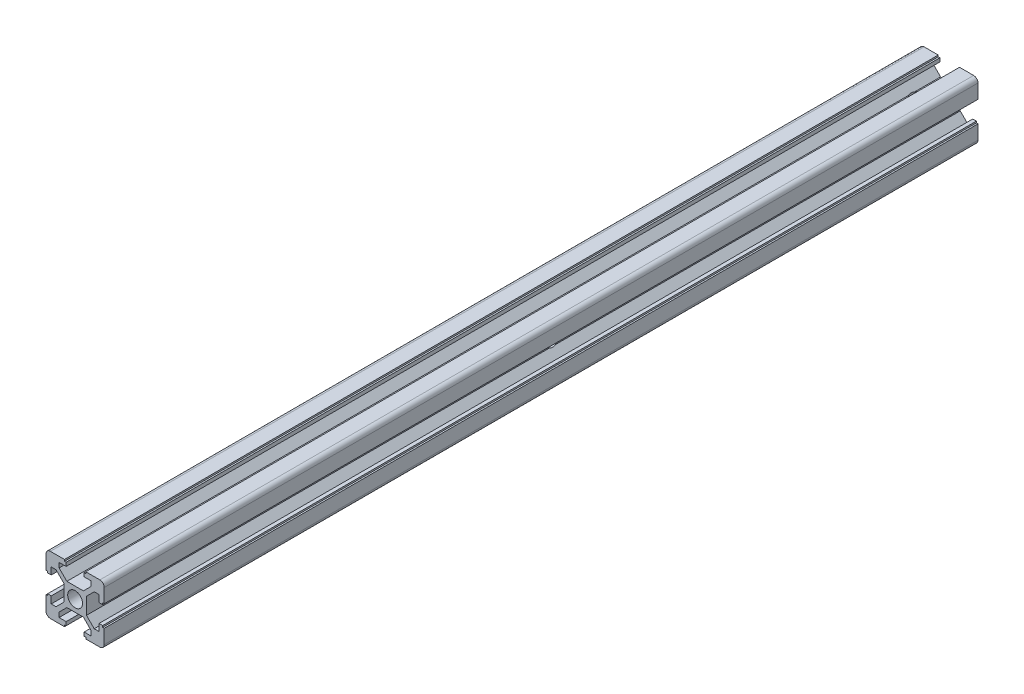
from build123d import *

# Parameters (mm, degrees)
SKETCH_1_R          = 2.55
EXTRUDE_1_DEPTH     = 300
SKETCH_2_R          = 3
CUT_EXTRUDE_1_DEPTH = 301.83217913
SKETCH_3_R          = 3
CUT_EXTRUDE_2_DEPTH = 301.83217923


with BuildPart() as part:
    # 草图1 → 凸台-拉伸1 (new body)
    with BuildSketch(Plane.XY):
        with BuildLine():
            Line((-3.9, 2.839339828), (-6.560660172, 5.5))
            Line((-6.560660172, 5.5), (-8.2, 5.5))
            Line((-8.2, 5.5), (-8.2, 3.1))
            Line((-8.2, 3.1), (-9.45, 3.1))
            Line((-9.45, 3.1), (-9.45, 3.65))
            Line((-9.45, 3.65), (-10, 3.65))
            Line((-10, 3.65), (-10, 8.5))
            ThreePointArc((-10, 8.5), (-9.560660172, 9.560660172), (-8.5, 10))
            Line((-8.5, 10), (-3.65, 10))
            Line((-3.65, 10), (-3.65, 9.45))
            Line((-3.65, 9.45), (-3.1, 9.45))
            Line((-3.1, 9.45), (-3.1, 8.2))
            Line((-3.1, 8.2), (-5.5, 8.2))
            Line((-5.5, 8.2), (-5.5, 6.560660172))
            Line((-5.5, 6.560660172), (-2.839339828, 3.9))
            Line((-2.839339828, 3.9), (2.839339828, 3.9))
            Line((2.839339828, 3.9), (5.5, 6.560660172))
            Line((5.5, 6.560660172), (5.5, 8.2))
            Line((5.5, 8.2), (3.1, 8.2))
            Line((3.1, 8.2), (3.1, 9.45))
            Line((3.1, 9.45), (3.65, 9.45))
            Line((3.65, 9.45), (3.65, 10))
            Line((3.65, 10), (8.5, 10))
            ThreePointArc((8.5, 10), (9.560660172, 9.560660172), (10, 8.5))
            Line((10, 8.5), (10, 3.65))
            Line((10, 3.65), (9.45, 3.65))
            Line((9.45, 3.65), (9.45, 3.1))
            Line((9.45, 3.1), (8.2, 3.1))
            Line((8.2, 3.1), (8.2, 5.5))
            Line((8.2, 5.5), (6.560660172, 5.5))
            Line((6.560660172, 5.5), (3.9, 2.839339828))
            Line((3.9, 2.839339828), (3.9, -2.839339828))
            Line((3.9, -2.839339828), (6.560660172, -5.5))
            Line((6.560660172, -5.5), (8.2, -5.5))
            Line((8.2, -5.5), (8.2, -3.1))
            Line((8.2, -3.1), (9.45, -3.1))
            Line((9.45, -3.1), (9.45, -3.65))
            Line((9.45, -3.65), (10, -3.65))
            Line((10, -3.65), (10, -8.5))
            ThreePointArc((10, -8.5), (9.560660172, -9.560660172), (8.5, -10))
            Line((8.5, -10), (3.65, -10))
            Line((3.65, -10), (3.65, -9.45))
            Line((3.65, -9.45), (3.1, -9.45))
            Line((3.1, -9.45), (3.1, -8.2))
            Line((3.1, -8.2), (5.5, -8.2))
            Line((5.5, -8.2), (5.5, -6.560660172))
            Line((5.5, -6.560660172), (2.839339828, -3.9))
            Line((2.839339828, -3.9), (-2.839339828, -3.9))
            Line((-2.839339828, -3.9), (-5.5, -6.560660172))
            Line((-5.5, -6.560660172), (-5.5, -8.2))
            Line((-5.5, -8.2), (-3.1, -8.2))
            Line((-3.1, -8.2), (-3.1, -9.45))
            Line((-3.1, -9.45), (-3.65, -9.45))
            Line((-3.65, -9.45), (-3.65, -10))
            Line((-3.65, -10), (-8.5, -10))
            ThreePointArc((-8.5, -10), (-9.560660172, -9.560660172), (-10, -8.5))
            Line((-10, -8.5), (-10, -3.65))
            Line((-10, -3.65), (-9.45, -3.65))
            Line((-9.45, -3.65), (-9.45, -3.1))
            Line((-9.45, -3.1), (-8.2, -3.1))
            Line((-8.2, -3.1), (-8.2, -5.5))
            Line((-8.2, -5.5), (-6.560660172, -5.5))
            Line((-6.560660172, -5.5), (-3.9, -2.839339828))
            Line((-3.9, -2.839339828), (-3.9, 2.839339828))
        make_face()
        Circle(SKETCH_1_R, mode=Mode.SUBTRACT)
    extrude(amount=EXTRUDE_1_DEPTH)

    # 草图2 → 切除-拉伸1 (cut, through all)
    with BuildSketch(Plane(origin=(0, 10, 0), x_dir=(1, 0, 0), z_dir=(0, 1, 0))):
        with Locations(Location((0, -10, 0), (0, 0, 198.835996158))):
            Circle(SKETCH_2_R)
    extrude(amount=-CUT_EXTRUDE_1_DEPTH, mode=Mode.SUBTRACT)

    # 草图3 → 切除-拉伸2 (cut, through all)
    with BuildSketch(Plane(origin=(10, 0, 0), x_dir=(0, 0, -1), z_dir=(1, 0, 0))):
        with Locations(Location((-140, 0, 0), (0, 0, 71.164003842))):
            Circle(SKETCH_3_R)
    extrude(amount=-CUT_EXTRUDE_2_DEPTH, mode=Mode.SUBTRACT)


solid = part.part
